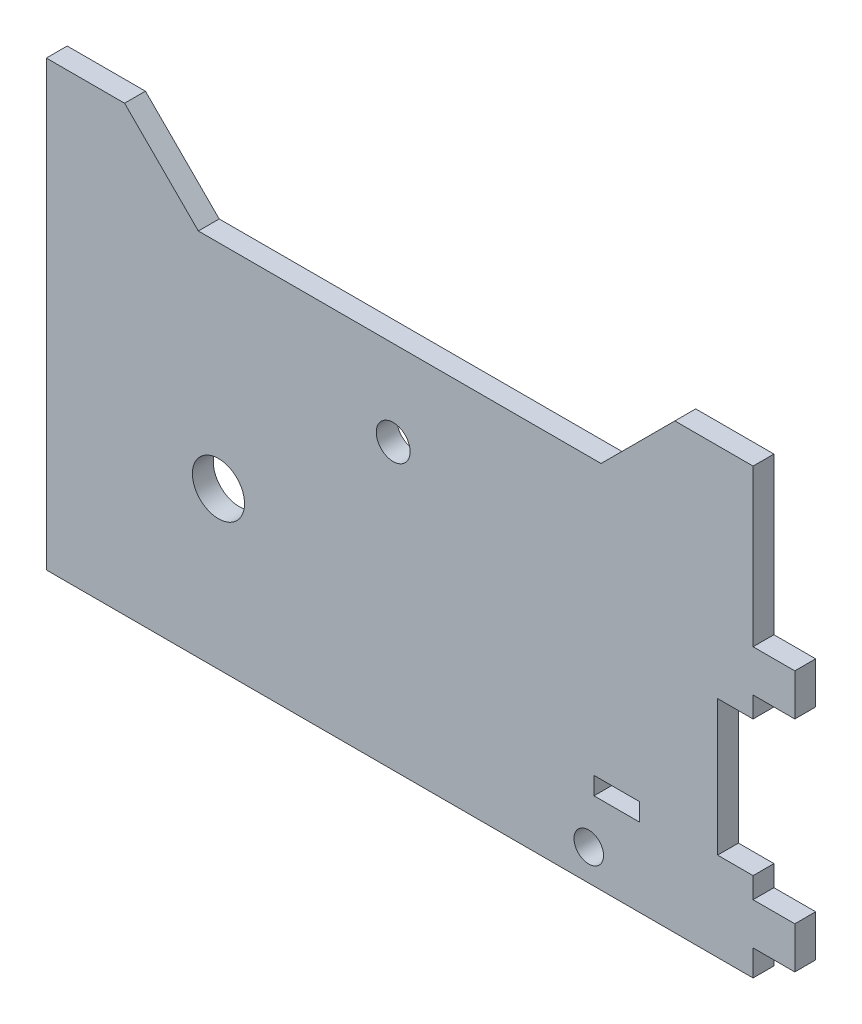
from build123d import *

# Parameters (mm, degrees)
SKETCH1_R           = 5
SKETCH1_R_2         = 2.83
SKETCH1_R_3         = 3.25
SKETCH1_W           = 8.7
SKETCH1_H           = 3.4
BOSS_EXTRUDE1_DEPTH = 4
BOSS_EXTRUDE2_DEPTH = 4


with BuildPart() as part:
    # Sketch1 → Boss-Extrude1 (new body)
    with BuildSketch(Plane.XY):
        Polygon((49, 30), (56.5, 30), (56.5, 25), (64.5, 25), (64.5, 17), (56.5, 17), (56.5, 13), (49.7, 13), (49.7, -13), (56.5, -13), (56.5, -17), (64.5, -17), (64.5, -25), (56.5, -25), (56.5, -30), (49, -30), (-79, -30), (-79, 30), align=None)
        with Locations((-46, 0)):
            Circle(SKETCH1_R, mode=Mode.SUBTRACT)
        with Locations((25, -24)):
            Circle(SKETCH1_R_2, mode=Mode.SUBTRACT)
        with Locations((-12.5, 24.5)):
            Circle(SKETCH1_R_3, mode=Mode.SUBTRACT)
        with Locations((30.35, -13.3)):
            Rectangle(SKETCH1_W, SKETCH1_H, mode=Mode.SUBTRACT)
    extrude(amount=BOSS_EXTRUDE1_DEPTH)

    # Sketch2 → Boss-Extrude2 (add)
    with BuildSketch(Plane.XY):
        Polygon((-79, 30), (56.5, 30), (56.5, 55), (41.5, 55), (27.357864376, 40.857864376), (-49.857864376, 40.857864376), (-64, 55), (-79, 55), align=None)
    extrude(amount=BOSS_EXTRUDE2_DEPTH)


solid = part.part
